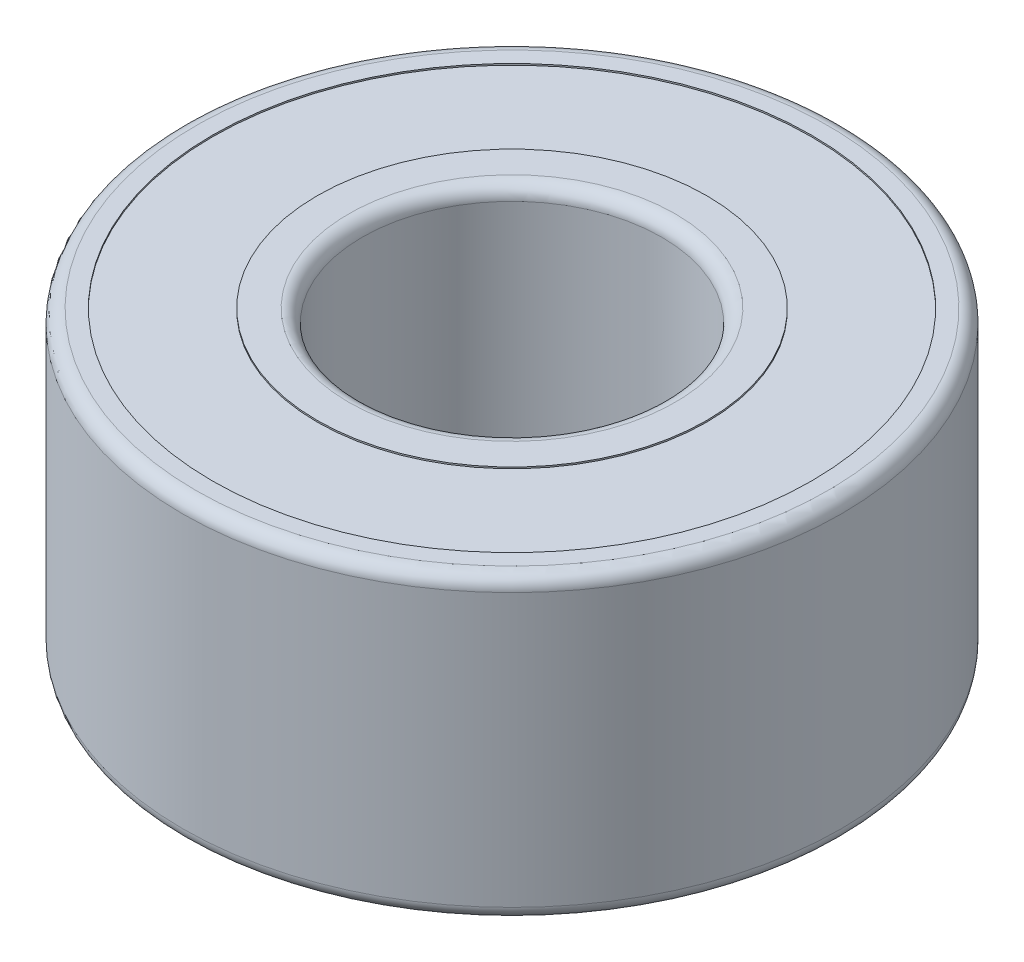
from build123d import *

# Parameters (mm, degrees)
SKETCH1_R           = 11
SKETCH1_R_2         = 5
BOSS_EXTRUDE1_DEPTH = 5
SKETCH2_R           = 10
SKETCH2_R_2         = 6.5
CUT_EXTRUDE1_DEPTH  = 0.05
FILLET1_R           = 0.45


with BuildPart() as part:
    # Sketch1 → Boss-Extrude1 (new, symmetric)
    with BuildSketch(Plane(origin=(0, 0, 0), x_dir=(1, 0, 0), z_dir=(0, 1, 0))):
        Circle(SKETCH1_R)
        Circle(SKETCH1_R_2, mode=Mode.SUBTRACT)
    extrude(amount=BOSS_EXTRUDE1_DEPTH, both=True)

    # Sketch2 → Cut-Extrude1 (cut)
    with BuildSketch(Plane(origin=(0, 5, 0), x_dir=(1, 0, 0), z_dir=(0, 1, 0))):
        Circle(SKETCH2_R)
        Circle(SKETCH2_R_2, mode=Mode.SUBTRACT)
    cut_extrude1 = extrude(amount=-CUT_EXTRUDE1_DEPTH, mode=Mode.SUBTRACT)

    # Mirror1: Cut-Extrude1 across plane
    add(cut_extrude1.mirror(Plane.ZX), mode=Mode.SUBTRACT)

    # Fillet1
    fillet1_edges = [part.edges().sort_by_distance(p)[0] for p in [
        (-11, -5, 0),
        (-5, -5, 0),
        (-5, 5, 0),
        (-11, 5, 0),
    ]]
    fillet(fillet1_edges, radius=FILLET1_R)


solid = part.part
